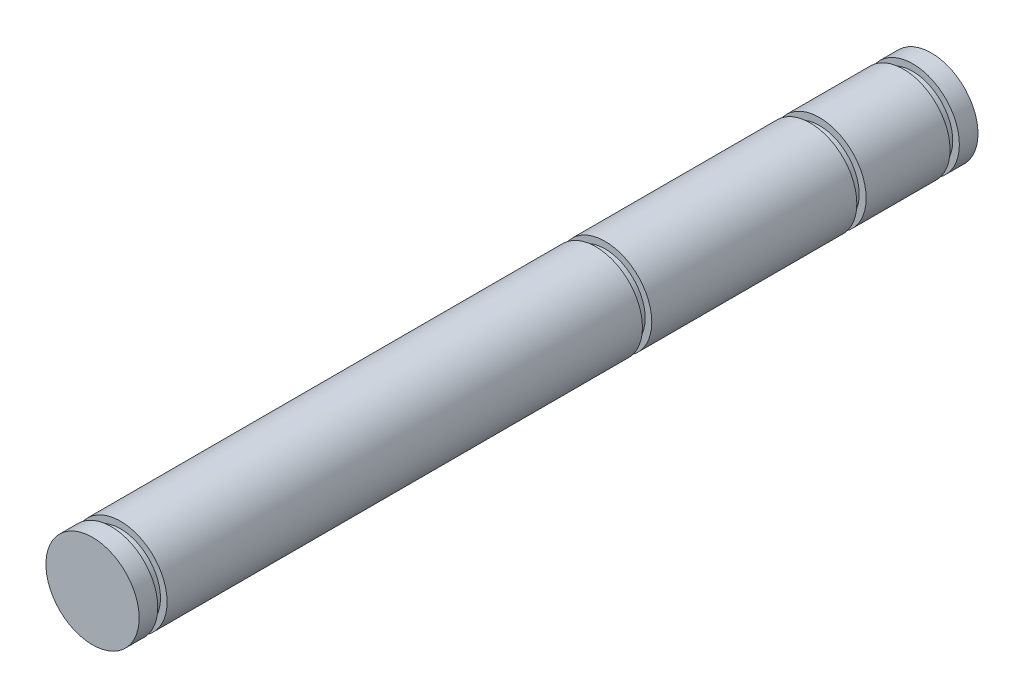
from build123d import *


with BuildPart() as part:
    # Skizze1 → Rotation1 (revolve)
    with BuildSketch(Plane(origin=(0, 0, 0), x_dir=(0, 0, -1), z_dir=(1, 0, 0)), mode=Mode.PRIVATE) as rotation1_sk:
        Polygon((-7.315845432, 0), (-7.315845432, 5), (-5.315845432, 5), (-5.315845432, 4.292030432), (-4.315845432, 4.292030432), (-4.315845432, 5), (46.684154568, 5), (46.684154568, 4.292030432), (47.684154568, 4.292030432), (47.684154568, 5), (69.684154568, 5), (69.684154568, 4.255858279), (70.684154568, 4.255858279), (70.684154568, 5), (79.684154568, 5), (79.684154568, 4.292030432), (80.684154568, 4.292030432), (80.684154568, 5), (82.684154568, 5), (82.684154568, 0), align=None)
    revolve(rotation1_sk.sketch.rotate(Axis((0, 0, 7.315845432), (0, 0, -1)), 90), axis=Axis((0, 0, 7.315845432), (0, 0, -1)))


solid = part.part
